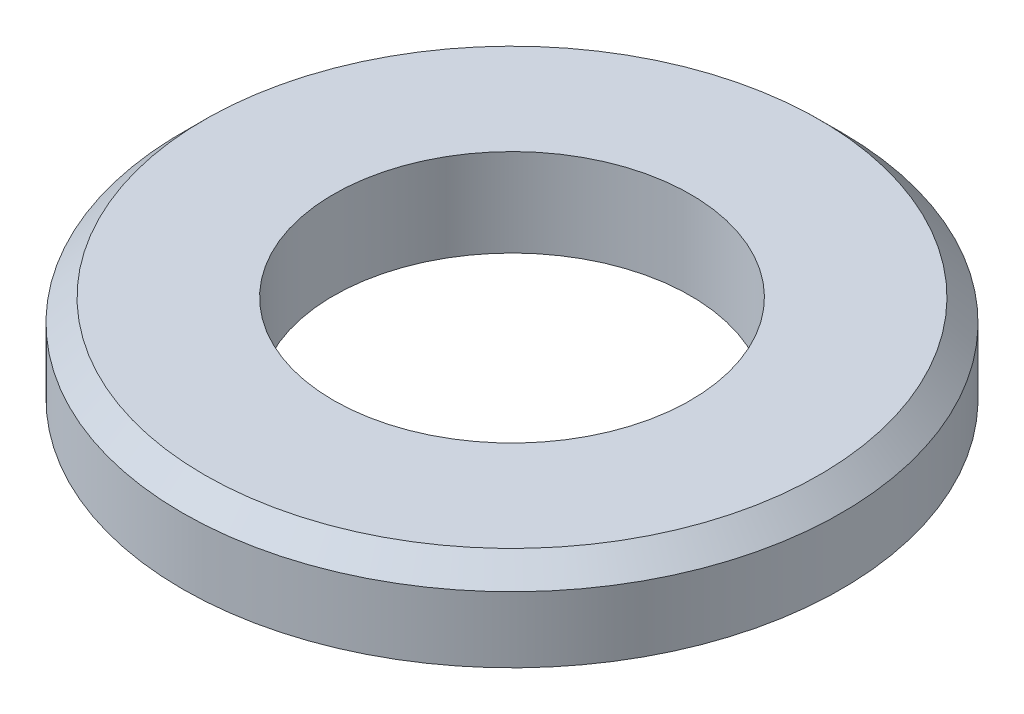
from build123d import *

# Parameters (mm, degrees)
SKETCH_1_R      = 6
SKETCH_1_R_2    = 3.25
EXTRUDE_1_DEPTH = 1.6
CHAMFER_1_SIZE  = 0.4


with BuildPart() as part:
    # 草图1 → 凸台-拉伸1 (new body)
    with BuildSketch(Plane(origin=(0, 0, 0), x_dir=(1, 0, 0), z_dir=(0, 1, 0))):
        with Locations(Location((0, 0, 0), (0, 0, 270))):
            Circle(SKETCH_1_R)
        with Locations(Location((0, 0, 0), (0, 0, 270))):
            Circle(SKETCH_1_R_2, mode=Mode.SUBTRACT)
    extrude(amount=EXTRUDE_1_DEPTH)

    # 倒角1
    chamfer_1_edges = [part.edges().sort_by_distance(p)[0] for p in [
        (0, 1.6, -6),
    ]]
    chamfer(chamfer_1_edges, length=CHAMFER_1_SIZE)


solid = part.part
